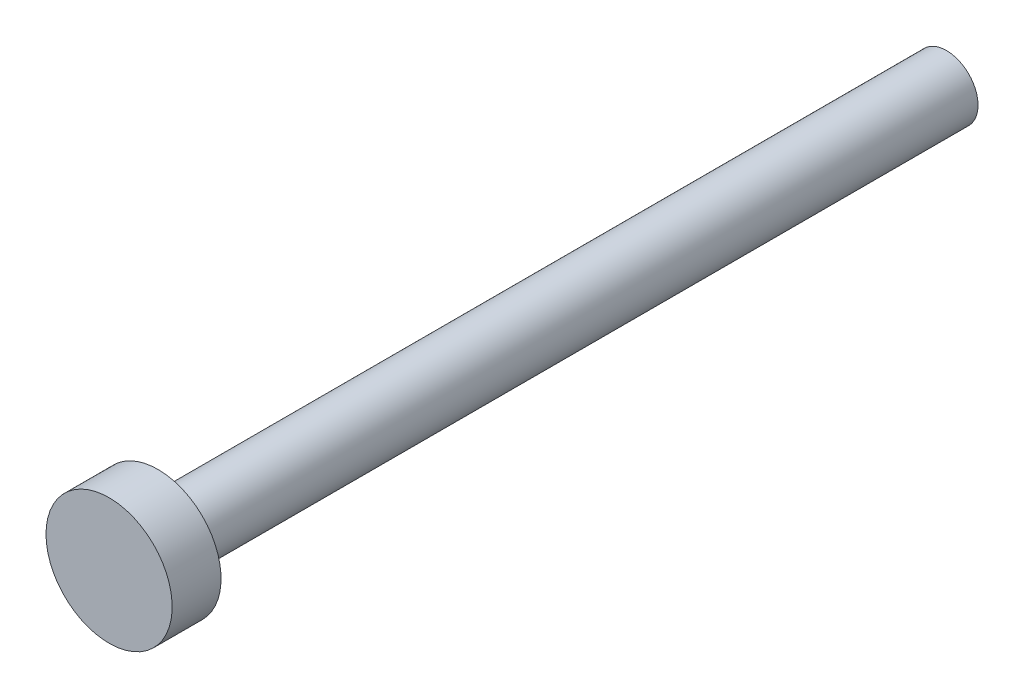
from build123d import *

# Parameters (mm, degrees)
ESQUISSE1_R        = 4
BOSS_EXTRU_1_DEPTH = 3.1
ESQUISSE2_R        = 2
BOSS_EXTRU_2_DEPTH = 50


with BuildPart() as part:
    # Esquisse1 → Boss.-Extru.1 (new body)
    with BuildSketch(Plane.XY):
        with Locations(Location((0, 0, 0), (0, 0, 180))):
            Circle(ESQUISSE1_R)
    extrude(amount=BOSS_EXTRU_1_DEPTH)

    # Esquisse2 → Boss.-Extru.2 (add)
    with BuildSketch(Plane(origin=(0, 0, 0), x_dir=(-1, 0, 0), z_dir=(0, 0, -1))):
        Circle(ESQUISSE2_R)
    extrude(amount=BOSS_EXTRU_2_DEPTH)


solid = part.part
